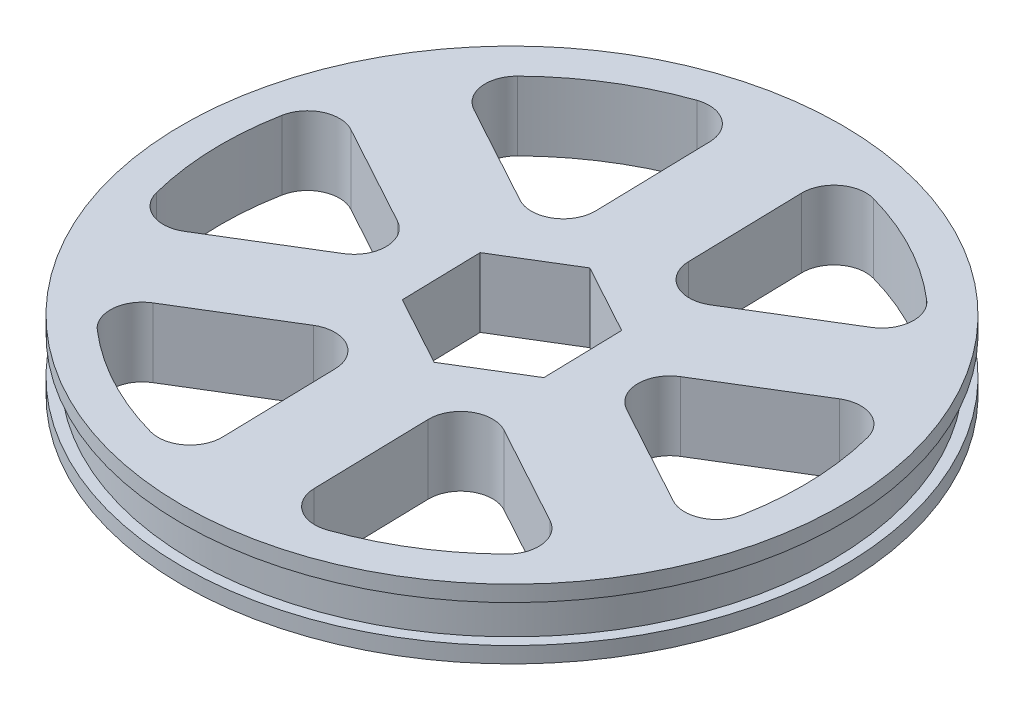
from build123d import *

# Parameters (mm, degrees)
SKETCH1_R                = 30
BOSS_EXTRUDE1_DEPTH      = 6.5
SKETCH1_4_R              = 31
SKETCH1_4_R_2            = 30
BOSS_EXTRUDE3_DEPTH      = 1.5
BOSS_EXTRUDE4_START      = -1.5
SKETCH4_R                = 31
BOSS_EXTRUDE4_DEPTH      = 1.5
CUT_EXTRUDE1_DEPTH       = 45.319860108
CUT_EXTRUDE2_DEPTH       = 45.319860108
FILLET1_R                = 3
CIRPATTERN1_COUNT        = 6
FILLET1_OF_CIRPATTERN1_R = 3


with BuildPart() as part:
    # Sketch1 → Boss-Extrude1 (new body)
    with BuildSketch(Plane(origin=(0, 0, 0), x_dir=(1, 0, 0), z_dir=(0, 1, 0))):
        Circle(SKETCH1_R)
    extrude(amount=BOSS_EXTRUDE1_DEPTH)

    # Sketch1<4> → Boss-Extrude3 (add)
    with BuildSketch(Plane(origin=(0, 0, 0), x_dir=(1, 0, 0), z_dir=(0, 1, 0))):
        Circle(SKETCH1_4_R)
        Circle(SKETCH1_4_R_2, mode=Mode.SUBTRACT)
    extrude(amount=BOSS_EXTRUDE3_DEPTH)

    # Sketch4 → Boss-Extrude4 (add)
    with BuildSketch(Plane(origin=(0, 6.5, 0), x_dir=(1, 0, 0), z_dir=(0, 1, 0)).offset(BOSS_EXTRUDE4_START)):
        Circle(SKETCH4_R)
    extrude(amount=BOSS_EXTRUDE4_DEPTH)

    # Sketch6 → Cut-Extrude1 (cut, through all)
    with BuildSketch(Plane(origin=(0, 6.5, 0), x_dir=(1, 0, 0), z_dir=(0, 1, 0))):
        Polygon((-6.589092189, 3.594050285), (-6.407084944, -3.909296081), (0.182007245, -7.503346367), (6.589092189, -3.594050285), (6.407084944, 3.909296081), (-0.182007245, 7.503346367), align=None)
    extrude(amount=-CUT_EXTRUDE1_DEPTH, mode=Mode.SUBTRACT)

    # Sketch7 → Cut-Extrude2 (cut, through all)
    with BuildSketch(Plane(origin=(0, 6.5, 0), x_dir=(1, 0, 0), z_dir=(0, 1, 0))):
        with BuildLine():
            Line((-4.427257323, 7.255990118), (-21.836731707, 16.752067056))
            ThreePointArc((-21.836731707, 16.752067056), (-14.339422173, 23.556707036), (-4.912250855, 27.250108785))
            Line((-4.912250855, 27.250108785), (-4.427257323, 7.255990118))
        make_face()
    cut_extrude2 = extrude(amount=-CUT_EXTRUDE2_DEPTH, mode=Mode.SUBTRACT)

    # Fillet1
    fillet1_edges = [part.edges().sort_by_distance(p)[0] for p in [
        (-4.427257323, 3.25, -7.255990118),
        (-4.912250855, 3.25, -27.250108785),
        (-21.836731707, 3.25, -16.752067056),
    ]]
    fillet(fillet1_edges, radius=FILLET1_R)

    # CirPattern1: Cut-Extrude2 ×6 about axis
    cirpattern1_axis = Axis((0, 6.5, 0), (0, 1, 0))
    for i in range(1, CIRPATTERN1_COUNT):
        add(cut_extrude2.rotate(cirpattern1_axis, i * 360 / CIRPATTERN1_COUNT), mode=Mode.SUBTRACT)

    # Fillet1 of CirPattern1
    fillet1_of_cirpattern1_edges = [part.edges().sort_by_distance(p)[0] for p in [
        (-8.497500434, 3.25, 0.206122251),
        (-26.055411892, 3.25, -9.370920362),
        (-25.42608149, 3.25, 10.535130867),
        (-4.070243111, 3.25, 7.46211237),
        (-21.143161036, 3.25, 17.879188423),
        (-3.589349782, 3.25, 27.287197922),
        (4.427257323, 3.25, 7.255990118),
        (4.912250855, 3.25, 27.250108785),
        (21.836731707, 3.25, 16.752067056),
        (8.497500434, 3.25, -0.206122251),
        (26.055411892, 3.25, 9.370920362),
        (25.42608149, 3.25, -10.535130867),
        (4.070243111, 3.25, -7.46211237),
        (21.143161036, 3.25, -17.879188423),
        (3.589349782, 3.25, -27.287197922),
    ]]
    fillet(fillet1_of_cirpattern1_edges, radius=FILLET1_OF_CIRPATTERN1_R)


solid = part.part
